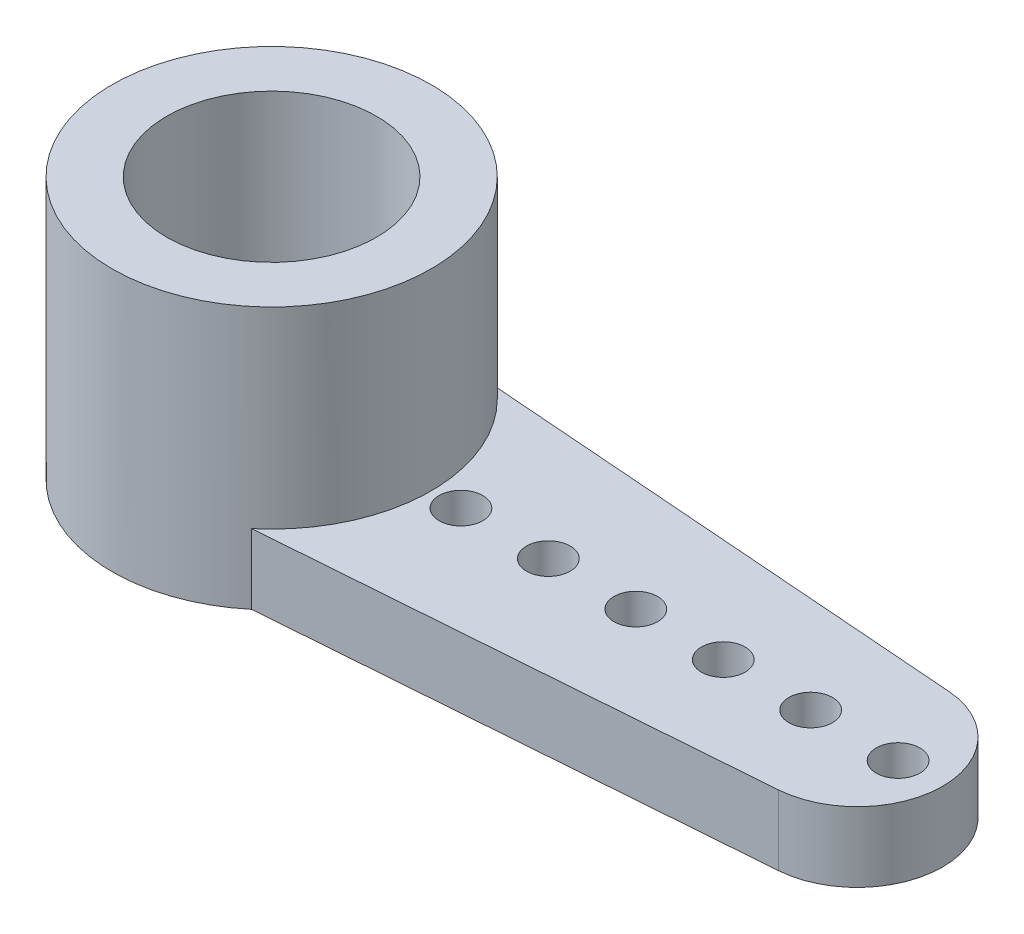
from build123d import *

# Parameters (mm, degrees)
SKETCH1_R           = 3.65
SKETCH1_R_2         = 2.4
SKETCH1_R_3         = 1.6
SKETCH1_R_4         = 0.5
BOSS_EXTRUDE1_DEPTH = 1.6
SKETCH1_3_R         = 3.65
SKETCH1_3_R_2       = 2.4
BOSS_EXTRUDE2_DEPTH = 6
SKETCH1_4_R         = 2.4
SKETCH1_4_R_2       = 1.6
CUT_EXTRUDE1_DEPTH  = 1


with BuildPart() as part:
    # Sketch1 → Boss-Extrude1 (new body)
    # profile 1 of 3: a face of its own
    with BuildSketch(Plane(origin=(0, 0, 0), x_dir=(1, 0, 0), z_dir=(0, 1, 0))):
        with Locations((-17.661574497, 0)):
            Circle(SKETCH1_R)
        with Locations((-17.661574497, 0)):
            Circle(SKETCH1_R_2, mode=Mode.SUBTRACT)
    # profile 2 of 3: a face of its own
    with BuildSketch(Plane(origin=(0, 0, 0), x_dir=(1, 0, 0), z_dir=(0, 1, 0))):
        with Locations((-17.661574497, 0)):
            Circle(SKETCH1_R_2)
        with Locations(Location((-17.661574497, 0, 0), (0, 0, 270))):
            Circle(SKETCH1_R_3, mode=Mode.SUBTRACT)
    # profile 3 of 3: a face of its own
    with BuildSketch(Plane(origin=(0, 0, 0), x_dir=(1, 0, 0), z_dir=(0, 1, 0))):
        with BuildLine():
            Line((-4.119202068, 1.95), (-15.320100602, 2.8))
            ThreePointArc((-15.320100602, 2.8), (-14.35484804, 1.545334961), (-14.011574497, 0))
            ThreePointArc((-14.011574497, 0), (-14.35484804, -1.545334961), (-15.320100602, -2.8))
            Line((-15.320100602, -2.8), (-4.119202068, -1.95))
            ThreePointArc((-4.119202068, -1.95), (-2.311574497, 0), (-4.119202068, 1.95))
        make_face()
        with Locations(Location((-13.331400804, 0, 0), (0, 0, 270))):
            Circle(SKETCH1_R_4, mode=Mode.SUBTRACT)
        with Locations(Location((-11.331400804, 0, 0), (0, 0, 270))):
            Circle(SKETCH1_R_4, mode=Mode.SUBTRACT)
        with Locations(Location((-9.331400804, 0, 0), (0, 0, 270))):
            Circle(SKETCH1_R_4, mode=Mode.SUBTRACT)
        with Locations(Location((-7.331400804, 0, 0), (0, 0, 270))):
            Circle(SKETCH1_R_4, mode=Mode.SUBTRACT)
        with Locations(Location((-5.331400804, 0, 0), (0, 0, 270))):
            Circle(SKETCH1_R_4, mode=Mode.SUBTRACT)
        with Locations(Location((-3.331400804, 0, 0), (0, 0, 270))):
            Circle(SKETCH1_R_4, mode=Mode.SUBTRACT)
    extrude(amount=BOSS_EXTRUDE1_DEPTH)

    # Sketch1<3> → Boss-Extrude2 (add)
    with BuildSketch(Plane(origin=(0, 0, 0), x_dir=(1, 0, 0), z_dir=(0, 1, 0))):
        with Locations(Location((-17.661574497, 0, 0), (0, 0, 50.096260743))):
            Circle(SKETCH1_3_R)
        with Locations(Location((-17.661574497, 0, 0), (0, 0, 270))):
            Circle(SKETCH1_3_R_2, mode=Mode.SUBTRACT)
    extrude(amount=BOSS_EXTRUDE2_DEPTH)

    # Sketch1<4> → Cut-Extrude1 (cut)
    with BuildSketch(Plane(origin=(0, 0, 0), x_dir=(1, 0, 0), z_dir=(0, 1, 0))):
        with Locations(Location((-17.661574497, 0, 0), (0, 0, 270))):
            Circle(SKETCH1_4_R)
        with Locations(Location((-17.661574497, 0, 0), (0, 0, 270))):
            Circle(SKETCH1_4_R_2, mode=Mode.SUBTRACT)
    extrude(amount=CUT_EXTRUDE1_DEPTH, mode=Mode.SUBTRACT)


solid = part.part
